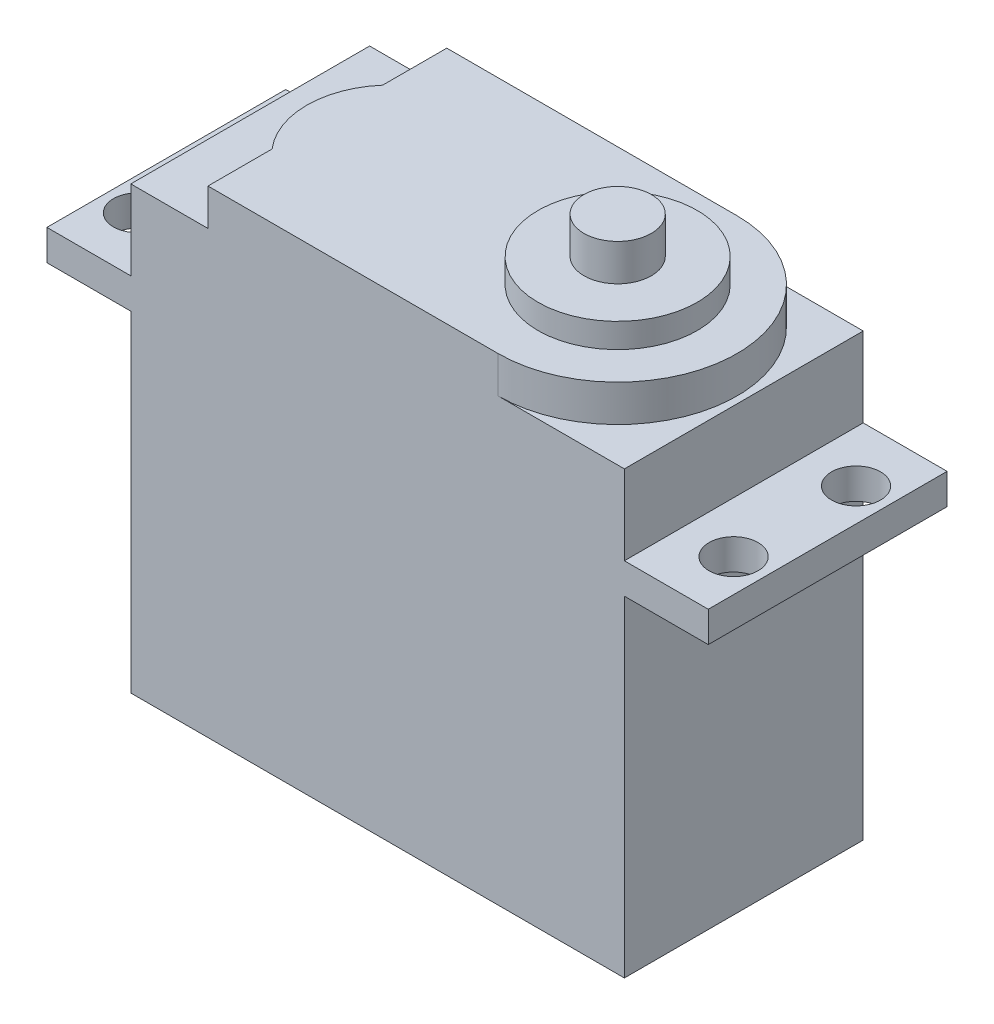
from build123d import *

# Parameters (mm, degrees)
SKETCH1_W               = 40.3
SKETCH1_H               = 19.5
BOSS_EXTRUDE1_DEPTH     = 27
SKETCH2_W               = 54
SKETCH2_H               = 19.5
BOSS_EXTRUDE2_DEPTH     = 2.5
SKETCH3_W               = 40.3
SKETCH3_H               = 19.5
BOSS_EXTRUDE3_DEPTH     = 6.5
SKETCH4_R               = 2.75
BOSS_EXTRUDE4_DEPTH     = 8
CUT_EXTRUDE1_DEPTH      = 42.162027404
CUT_EXTRUDE1_DEPTH_BACK = 42.162027404
SKETCH5_R               = 2
BOSS_EXTRUDE5_DEPTH     = 3
SKETCH7_R               = 6.5
BOSS_EXTRUDE6_DEPTH     = 2
BOSS_EXTRUDE7_DEPTH     = 3


with BuildPart() as part:
    # Sketch1 → Boss-Extrude1 (new body)
    with BuildSketch(Plane(origin=(0, 0, 0), x_dir=(1, 0, 0), z_dir=(0, 1, 0))):
        Rectangle(SKETCH1_W, SKETCH1_H)
    extrude(amount=BOSS_EXTRUDE1_DEPTH)

    # Sketch2 → Boss-Extrude2 (add)
    with BuildSketch(Plane(origin=(0, 27, 0), x_dir=(1, 0, 0), z_dir=(0, 1, 0))):
        Rectangle(SKETCH2_W, SKETCH2_H)
    extrude(amount=BOSS_EXTRUDE2_DEPTH)

    # Sketch3 → Boss-Extrude3 (add)
    with BuildSketch(Plane(origin=(0, 29.5, 0), x_dir=(1, 0, 0), z_dir=(0, 1, 0))):
        Rectangle(SKETCH3_W, SKETCH3_H)
    extrude(amount=BOSS_EXTRUDE3_DEPTH)

    # Sketch4 → Boss-Extrude4 (add)
    with BuildSketch(Plane(origin=(0, 36, 0), x_dir=(1, 0, 0), z_dir=(0, 1, 0))):
        with Locations(Location((9.85, 0, 0), (0, 0, 270))):
            Circle(SKETCH4_R)
    extrude(amount=BOSS_EXTRUDE4_DEPTH)

    # Sketch5 → Cut-Extrude1 (cut, two sides: drawn at the far end of the back side and taken through both)
    with BuildSketch(Plane(origin=(0, 29.5, 0), x_dir=(1, 0, 0), z_dir=(0, 1, 0)).offset(-CUT_EXTRUDE1_DEPTH_BACK)):
        with Locations(Location((-24.315, 5, 0), (0, 0, 270))):
            Circle(SKETCH5_R)
        with Locations(Location((-24.315, -5, 0), (0, 0, 270))):
            Circle(SKETCH5_R)
        with Locations(Location((24.315, -5, 0), (0, 0, 270))):
            Circle(SKETCH5_R)
        with Locations(Location((24.315, 5, 0), (0, 0, 270))):
            Circle(SKETCH5_R)
    extrude(amount=CUT_EXTRUDE1_DEPTH + CUT_EXTRUDE1_DEPTH_BACK, mode=Mode.SUBTRACT)

    # Sketch6 → Boss-Extrude5 (add)
    with BuildSketch(Plane(origin=(0, 36, 0), x_dir=(1, 0, 0), z_dir=(0, 1, 0))):
        with BuildLine():
            Line((9.85, -9.75), (-13.85, -9.75))
            Line((-13.85, -9.75), (-13.85, 9.75))
            Line((-13.85, 9.75), (9.85, 9.75))
            ThreePointArc((9.85, 9.75), (19.6, 0), (9.85, -9.75))
        make_face()
    extrude(amount=BOSS_EXTRUDE5_DEPTH)

    # Sketch7 → Boss-Extrude6 (add)
    with BuildSketch(Plane(origin=(0, 39, 0), x_dir=(1, 0, 0), z_dir=(0, 1, 0))):
        with Locations(Location((9.85, 0, 0), (0, 0, 270))):
            Circle(SKETCH7_R)
    extrude(amount=BOSS_EXTRUDE6_DEPTH)

    # Sketch8 → Boss-Extrude7 (add)
    with BuildSketch(Plane(origin=(0, 36, 0), x_dir=(1, 0, 0), z_dir=(0, 1, 0))):
        with BuildLine():
            Line((-13.85, 4.510933332), (-13.85, -4.510933332))
            ThreePointArc((-13.85, -4.510933332), (-15.530301972, 0), (-13.85, 4.510933332))
        make_face()
    extrude(amount=BOSS_EXTRUDE7_DEPTH)


solid = part.part
